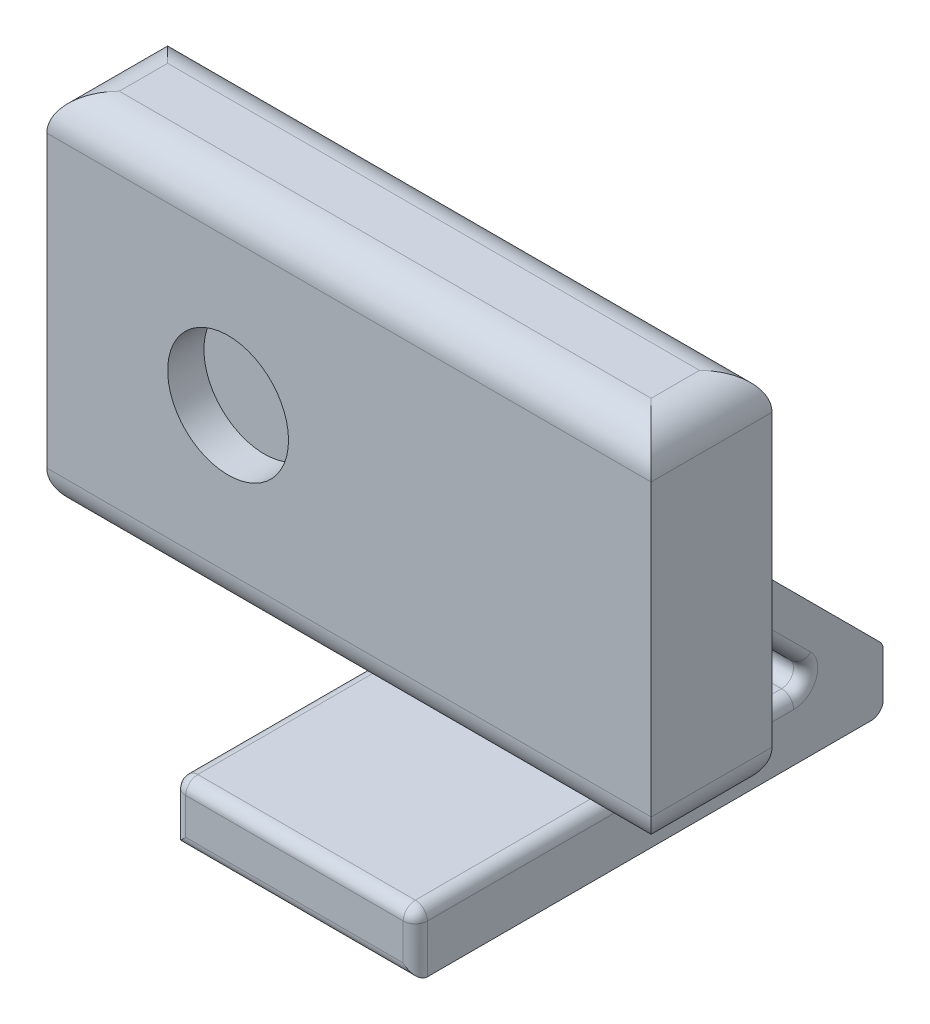
from build123d import *

# Parameters (mm, degrees)
SKETCH_1_W          = 50
SKETCH_1_H          = 30
EXTRUDE_1_DEPTH     = 10
EXTRUDE_2_DEPTH     = 10
SKETCH_3_R          = 5
CUT_EXTRUDE_1_DEPTH = 3
FILLET_1_R          = 3
FILLET_2_R          = 1


with BuildPart() as part:
    # 스케치1 → 보스-돌출1 (new body)
    with BuildSketch(Plane.XY):
        Rectangle(SKETCH_1_W, SKETCH_1_H)
    extrude(amount=EXTRUDE_1_DEPTH)

    # 스케치2 → 보스-돌출2 (add, symmetric)
    with BuildSketch(Plane(origin=(0, 0, 0), x_dir=(0, 0, -1), z_dir=(1, 0, 0))):
        Polygon((0, 0), (24.201197656, -24.201197656), (24.201197656, -29.201197656), (-14.510049854, -29.201197656), (-14.510049854, -24.201197656), (19.201197656, -24.201197656), (0, -5), align=None)
    extrude(amount=EXTRUDE_2_DEPTH, both=True)

    # 스케치3 → 컷-돌출1 (cut)
    with BuildSketch(Plane.XY.offset(10)):
        with Locations((-10, 0)):
            Circle(SKETCH_3_R)
    extrude(amount=-CUT_EXTRUDE_1_DEPTH, mode=Mode.SUBTRACT)

    # 필렛1
    fillet_1_edges = [part.edges().sort_by_distance(p)[0] for p in [
        (0, -15, 10),
        (0, -15, 0),
        (0, 15, 0),
        (25, -15, 5),
        (-25, -15, 5),
        (-25, 15, 5),
        (25, 15, 5),
        (0, 15, 10),
    ]]
    fillet(fillet_1_edges, radius=FILLET_1_R)

    # 필렛2
    fillet_2_edges = [part.edges().sort_by_distance(p)[0] for p in [
        (-10, -14.600598828, -9.600598828),
        (-10, -24.201197656, -2.345573901),
        (0, -24.201197656, -19.201197656),
        (-10, -26.701197656, 14.510049854),
        (0, -24.201197656, 14.510049854),
        (0, -29.201197656, 14.510049854),
        (0, -29.201197656, -24.201197656),
        (0, -24.201197656, -24.201197656),
        (10, -14.600598828, -9.600598828),
        (10, -24.201197656, -2.345573901),
        (10, -26.701197656, 14.510049854),
    ]]
    fillet(fillet_2_edges, radius=FILLET_2_R)


solid = part.part
